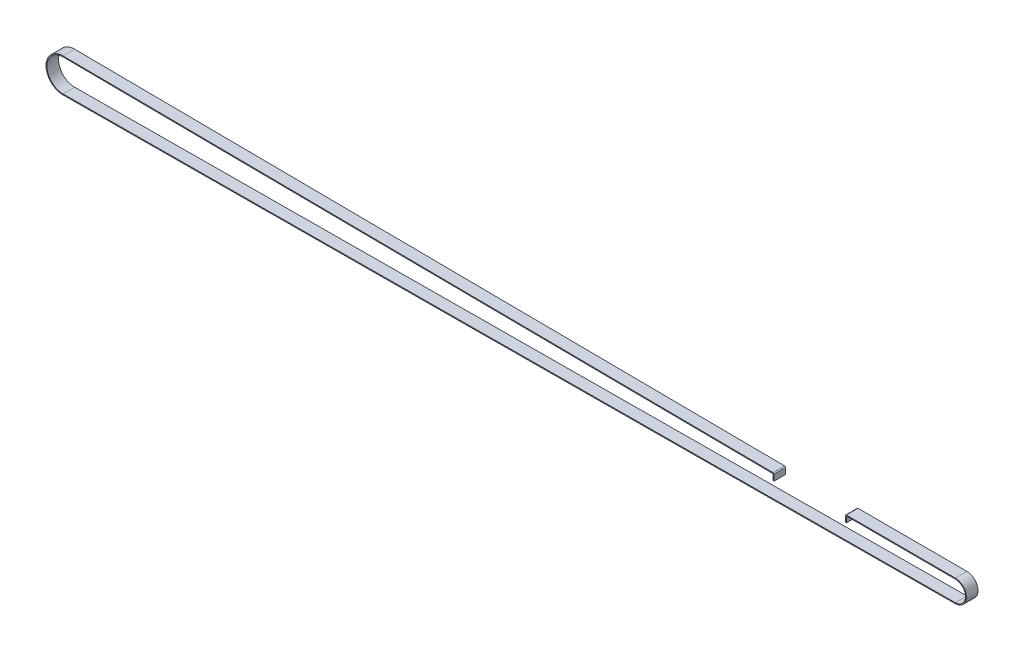
from build123d import *

# Parameters (mm, degrees)
EXTRUDE_THIN1_START = 1
EXTRUDE_THIN1_DEPTH = 6.35


with BuildPart() as part:
    # Sketch1 → Extrude-Thin1 (new body)
    with BuildSketch(Plane.XY.offset(EXTRUDE_THIN1_START)):
        with BuildLine():
            Line((388.165618503, 2.23097434), (388.165618503, 5.41097434))
            ThreePointArc((388.165618503, 5.41097434), (388.136623681, 5.481389287), (388.066453208, 5.510970857))
            Line((388.066453208, 5.510970857), (0.059901443, 8.749794959))
            ThreePointArc((0.059901443, 8.749794959), (-8.749999578, 0.002718342), (0.054464874, -8.749830488))
            Line((0.054464874, -8.749830488), (487.776522402, -5.713917899))
            ThreePointArc((487.776522402, -5.713917899), (493.304398035, -0.153253749), (487.779978506, 5.410843992))
            Line((487.779978506, 5.410843992), (428.265786749, 5.510974199))
            ThreePointArc((428.265786749, 5.510974199), (428.194967334, 5.481744477), (428.165618503, 5.41097434))
            Line((428.165618503, 5.41097434), (428.165618503, 2.23097434))
            Line((428.165618503, 2.23097434), (427.665618503, 2.23097434))
            Line((427.665618503, 2.23097434), (427.665618503, 5.41097434))
            ThreePointArc((427.665618503, 5.410974341), (427.841711488, 5.835595162), (428.266627977, 6.010973491))
            Line((428.266627977, 6.010973491), (487.78208283, 5.91084116))
            ThreePointArc((487.78208283, 5.91084116), (493.804398179, -0.15274976), (487.77963468, -6.213908213))
            Line((487.77963468, -6.213908213), (0.057577153, -9.249820802))
            ThreePointArc((0.057577153, -9.249820802), (-9.249999493, 0.003063934), (0.063704889, 9.249780629))
            Line((0.063704889, 9.249780629), (388.070626735, 6.010953438))
            ThreePointArc((388.070626735, 6.010953438), (388.491649569, 5.833464021), (388.665618503, 5.410974341))
            Line((388.665618503, 5.410974341), (388.665618503, 2.23097434))
            Line((388.665618503, 2.23097434), (388.165618503, 2.23097434))
        make_face()
    extrude(amount=EXTRUDE_THIN1_DEPTH)


solid = part.part
